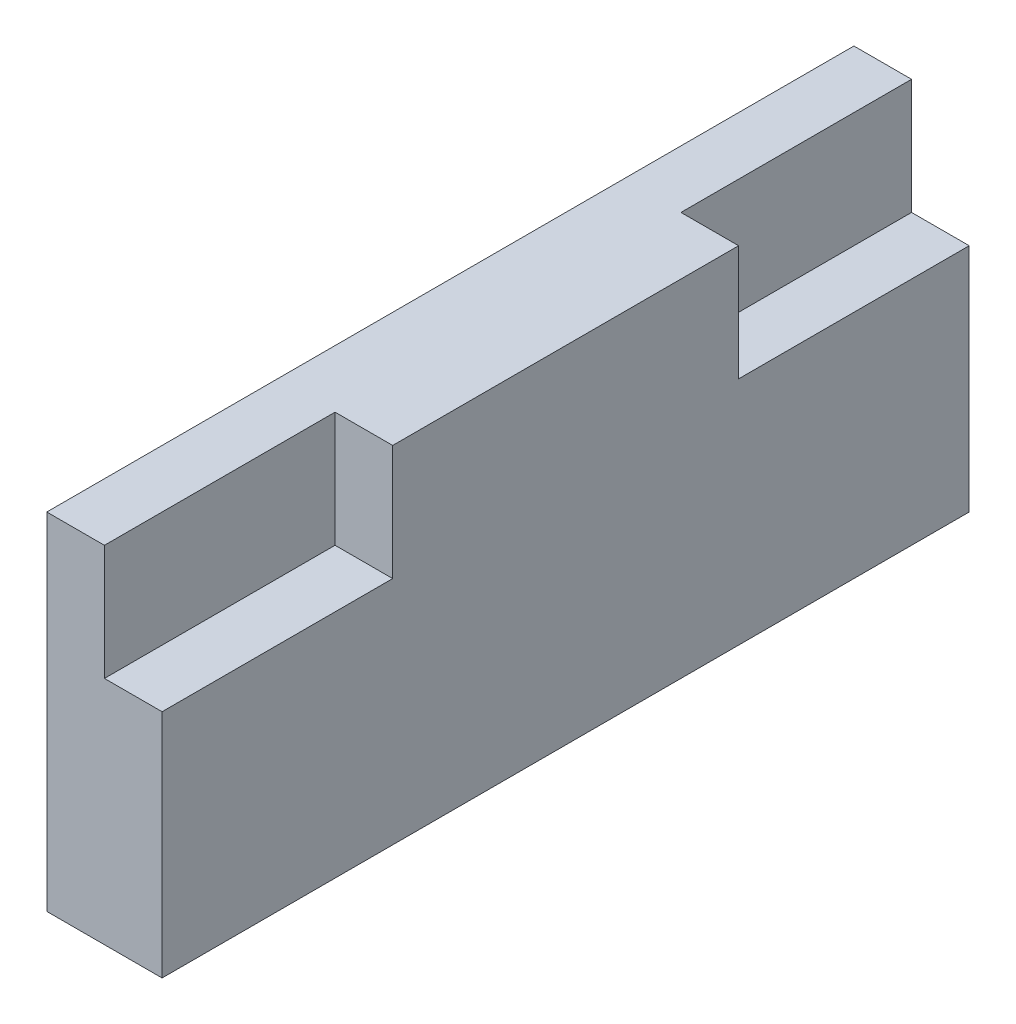
from build123d import *

# Parameters (mm, degrees)
SKETCH1_W           = 25.4
SKETCH1_H           = 177.8
BOSS_EXTRUDE1_DEPTH = 76.2
SKETCH2_W           = 50.8
SKETCH2_H           = 25.4
CUT_EXTRUDE1_DEPTH  = 12.7


with BuildPart() as part:
    # Sketch1 → Boss-Extrude1 (new body)
    with BuildSketch(Plane(origin=(0, 0, 0), x_dir=(1, 0, 0), z_dir=(0, 1, 0))):
        with Locations((-125.357758621, 27.343318966)):
            Rectangle(SKETCH1_W, SKETCH1_H)
    extrude(amount=BOSS_EXTRUDE1_DEPTH)

    # Sketch2 → Cut-Extrude1 (cut)
    with BuildSketch(Plane(origin=(-112.657758621, 0, 0), x_dir=(0, 0, -1), z_dir=(1, 0, 0))):
        with Locations((90.843318966, 63.5)):
            Rectangle(SKETCH2_W, SKETCH2_H)
        with Locations((-36.156681034, 63.5)):
            Rectangle(SKETCH2_W, SKETCH2_H)
    extrude(amount=-CUT_EXTRUDE1_DEPTH, mode=Mode.SUBTRACT)


solid = part.part
